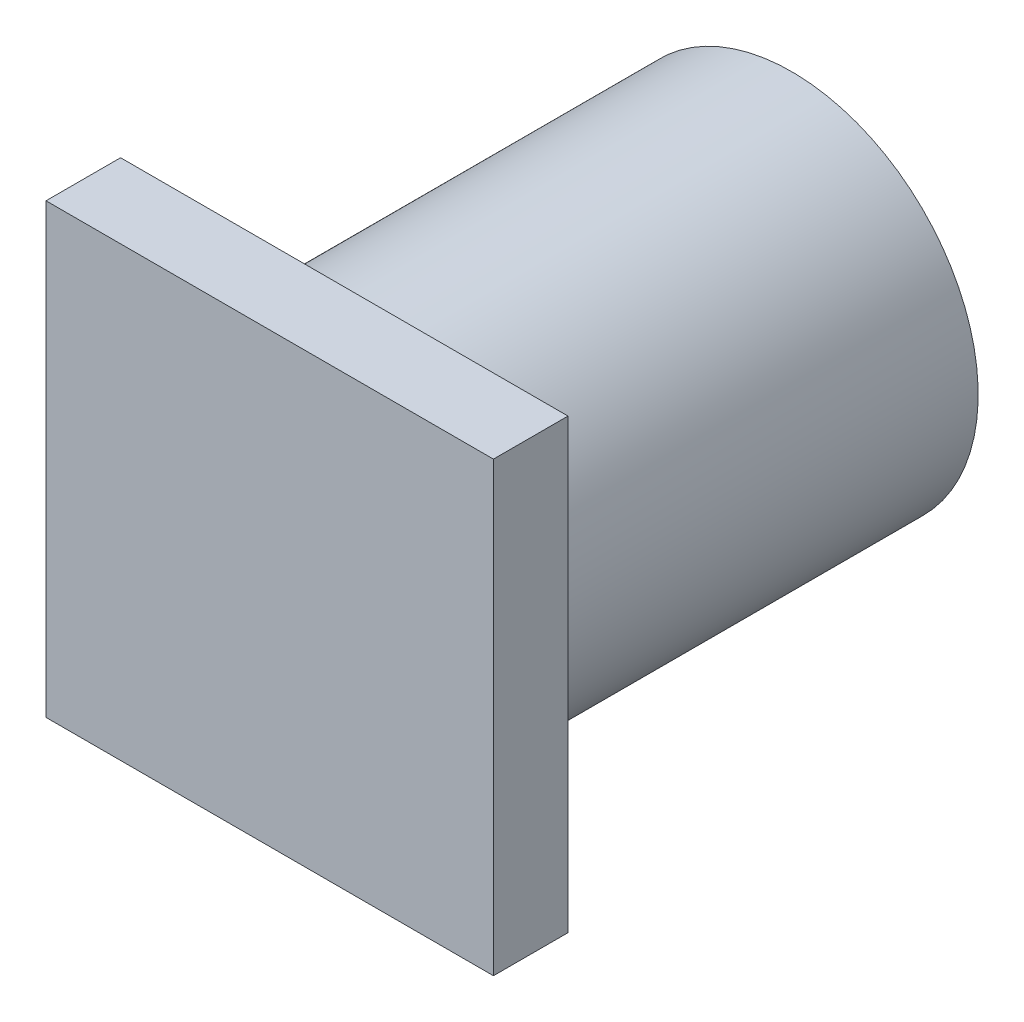
from build123d import *

# Parameters (mm, degrees)
ESQUISSE1_W        = 12
ESQUISSE1_H        = 12
BOSS_EXTRU_1_DEPTH = 2
ESQUISSE3_R        = 5
BOSS_EXTRU_2_DEPTH = 12


with BuildPart() as part:
    # Esquisse1 → Boss.-Extru.1 (new body)
    with BuildSketch(Plane.XY):
        Rectangle(ESQUISSE1_W, ESQUISSE1_H)
    extrude(amount=BOSS_EXTRU_1_DEPTH)

    # Esquisse3 → Boss.-Extru.2 (add)
    with BuildSketch(Plane(origin=(0, 0, 0), x_dir=(-1, 0, 0), z_dir=(0, 0, -1))):
        Circle(ESQUISSE3_R)
    extrude(amount=BOSS_EXTRU_2_DEPTH)


solid = part.part
